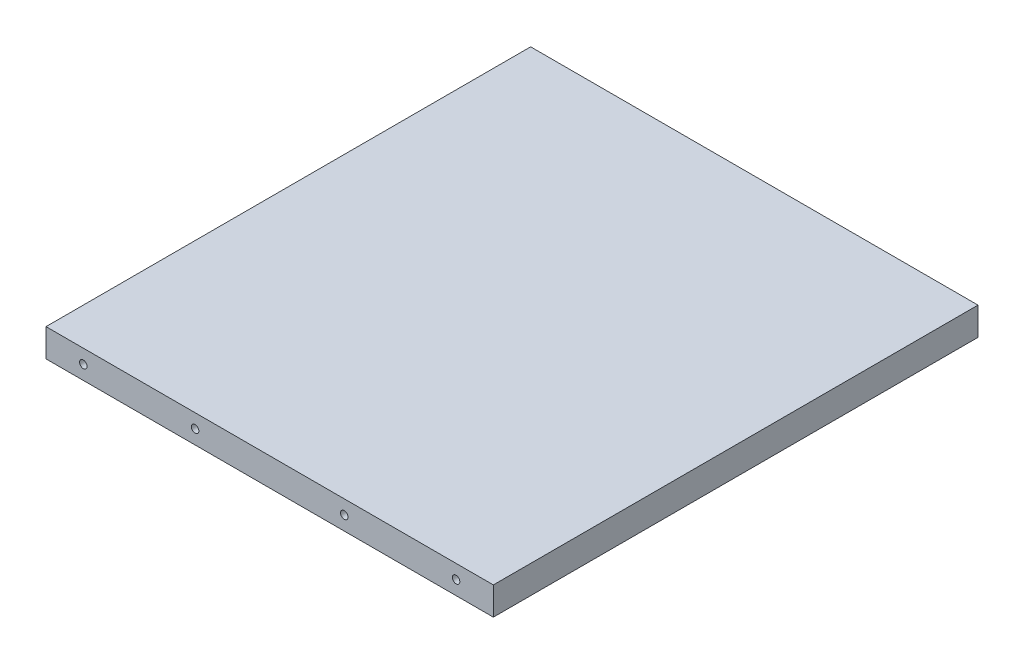
from build123d import *

# Parameters (mm, degrees)
SKETCH2_W                   = 304.8
SKETCH2_H                   = 330.2
BOSS_EXTRUDE1_DEPTH         = 9.525
F_1_4_20_TAPPED_HOLE1_D     = 5.1054
F_1_4_20_TAPPED_HOLE1_DEPTH = 38.1
F_1_4_20_TAPPED_HOLE1_TIP   = 1.533816902


with BuildPart() as part:
    # Sketch2 → Boss-Extrude1 (new, symmetric)
    with BuildSketch(Plane(origin=(0, 0, 0), x_dir=(1, 0, 0), z_dir=(0, 1, 0))):
        Rectangle(SKETCH2_W, SKETCH2_H)
    extrude(amount=BOSS_EXTRUDE1_DEPTH, both=True)

    # 1/4-20 Tapped Hole1
    with Locations(Plane.XY.offset(165.1)):
        with Locations((127, 0), (50.8, 0), (-50.8, 0), (-127, 0)):
            Hole(F_1_4_20_TAPPED_HOLE1_D / 2, depth=F_1_4_20_TAPPED_HOLE1_DEPTH)
            with Locations((0, 0, -(F_1_4_20_TAPPED_HOLE1_DEPTH + F_1_4_20_TAPPED_HOLE1_TIP / 2))):  # 118° drill point
                Cone(0, F_1_4_20_TAPPED_HOLE1_D / 2, F_1_4_20_TAPPED_HOLE1_TIP, mode=Mode.SUBTRACT)


solid = part.part
